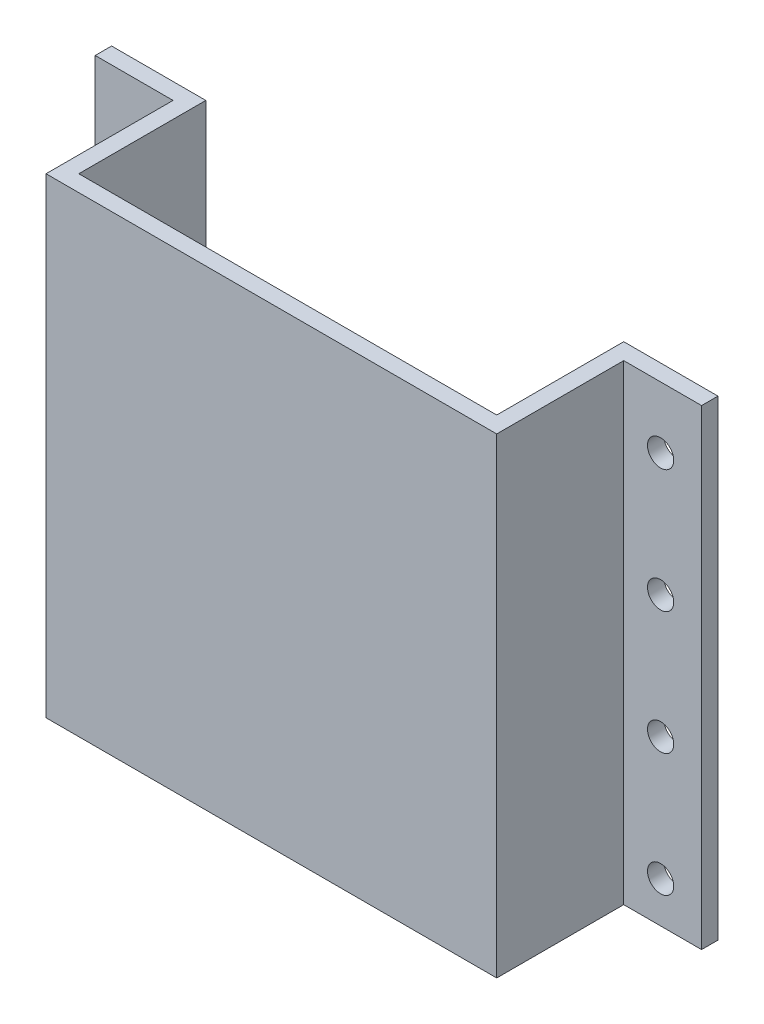
from build123d import *

# Parameters (mm, degrees)
EXTRUDE_1_DEPTH     = 70
SKETCH_2_W          = 51
SKETCH_2_H          = 15.5
EXTRUDE_2_DEPTH     = 5
SKETCH_3_R          = 1.6
CUT_EXTRUDE_1_DEPTH = 17
SKETCH_4_W          = 196.862371893
SKETCH_4_H          = 80.94669897
CUT_EXTRUDE_2_DEPTH = 12.5


with BuildPart() as part:
    # 草图1 → 凸台-拉伸1 (new body)
    with BuildSketch(Plane(origin=(0, 0, 0), x_dir=(1, 0, 0), z_dir=(0, 1, 0))):
        Polygon((-5.048022599, 0), (4.451977401, 0), (4.451977401, -15.5), (59.451977401, -15.5), (59.451977401, 0), (68.951977401, 0), (68.951977401, 2), (57.451977401, 2), (57.451977401, -13.5), (6.451977401, -13.5), (6.451977401, 2), (-5.048022599, 2), align=None)
    extrude(amount=EXTRUDE_1_DEPTH)

    # 草图2 → 凸台-拉伸2 (add)
    with BuildSketch(Plane.XZ):
        with Locations((31.951977401, 5.75)):
            Rectangle(SKETCH_2_W, SKETCH_2_H)
    extrude(amount=-EXTRUDE_2_DEPTH)

    # 草图3 → 切除-拉伸1 (cut)
    with BuildSketch(Plane.XY):
        with Locations((-0.048022599, 35)):
            Circle(SKETCH_3_R)
        with Locations((-0.048022599, 20)):
            Circle(SKETCH_3_R)
        with Locations((-0.048022599, 5)):
            Circle(SKETCH_3_R)
        with Locations((-0.048022599, 65)):
            Circle(SKETCH_3_R)
        with Locations((-0.048022599, 50)):
            Circle(SKETCH_3_R)
        with Locations((63.951977401, 50)):
            Circle(SKETCH_3_R)
        with Locations((63.951977401, 65)):
            Circle(SKETCH_3_R)
        with Locations((63.951977401, 5)):
            Circle(SKETCH_3_R)
        with Locations((63.951977401, 20)):
            Circle(SKETCH_3_R)
        with Locations((63.951977401, 35)):
            Circle(SKETCH_3_R)
    extrude(amount=-CUT_EXTRUDE_1_DEPTH, mode=Mode.SUBTRACT)

    # 草图4 → 切除-拉伸2 (cut)
    with BuildSketch(Plane(origin=(0, 70, 0), x_dir=(1, 0, 0), z_dir=(0, 1, 0))):
        with Locations((-17.870085989, 16.997485689)):
            Rectangle(SKETCH_4_W, SKETCH_4_H)
    extrude(amount=-CUT_EXTRUDE_2_DEPTH, mode=Mode.SUBTRACT)


solid = part.part
